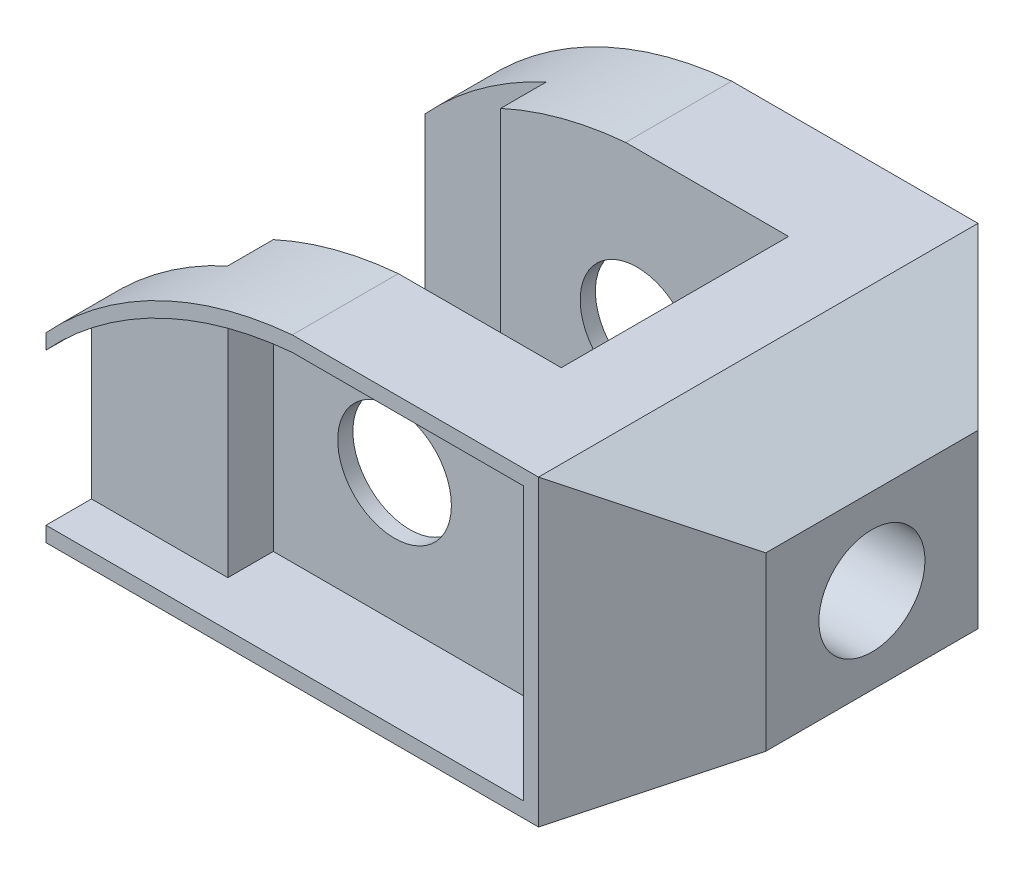
from build123d import *

# Parameters (mm, degrees)
SKETCH1_R               = 7.5
BOSS_EXTRUDE1_DEPTH     = 58
CUT_EXTRUDE1_DEPTH      = 58
SKETCH4_R               = 7
CUT_EXTRUDE2_DEPTH      = 58
CUT_EXTRUDE3_DEPTH      = 96.859271852
CUT_EXTRUDE3_DEPTH_BACK = 6
SKETCH5_R               = 7.5
CUT_EXTRUDE5_START      = -6
CUT_EXTRUDE5_DEPTH      = 6
CUT_EXTRUDE6_DEPTH      = 6
CUT_EXTRUDE7_DEPTH      = 6


with BuildPart() as part:
    # Sketch1 → Boss-Extrude1 (new body)
    with BuildSketch(Plane.XY):
        with BuildLine():
            Line((0, 0), (-65, 0))
            Line((-65, 0), (-65, 24))
            ThreePointArc((-65, 24), (-50.249936753, 35.04674653), (-32.5, 40))
            Line((-32.5, 40), (0, 40))
            Line((0, 40), (15, 31.339745962))
            Line((15, 31.339745962), (15, 8.660254038))
            Line((15, 8.660254038), (0, 0))
        make_face()
        with Locations((-31, 19)):
            Circle(SKETCH1_R, mode=Mode.SUBTRACT)
    extrude(amount=-BOSS_EXTRUDE1_DEPTH)

    # Sketch3 → Cut-Extrude1 (cut)
    with BuildSketch(Plane(origin=(0, 40, 0), x_dir=(1, 0, 0), z_dir=(0, 1, 0))):
        Polygon((-65, 50), (-49, 50), (-49, 44), (-11, 44), (-11, 14), (-49, 14), (-49, 8), (-65, 8), align=None)
        Polygon((0, 58), (15, 43), (15, 58), align=None)
        Polygon((0, 0), (15, 15), (15, 0), align=None)
    extrude(amount=-CUT_EXTRUDE1_DEPTH, mode=Mode.SUBTRACT)

    # Sketch4 → Cut-Extrude2 (cut)
    with BuildSketch(Plane(origin=(15, 0, 0), x_dir=(0, 0, -1), z_dir=(1, 0, 0))):
        with Locations(Location((29, 20, 0), (0, 0, 90))):
            Circle(SKETCH4_R)
    extrude(amount=-CUT_EXTRUDE2_DEPTH, mode=Mode.SUBTRACT)

    # Sketch5 → Cut-Extrude3 (cut, two sides: drawn at the far end of the back side and taken through both)
    with BuildSketch(Plane.XY.offset(-CUT_EXTRUDE3_DEPTH_BACK)):
        with BuildLine():
            Line((-65, 22), (-65, 2))
            Line((-65, 2), (-2, 2))
            Line((-2, 2), (-2, 38))
            Line((-2, 38), (-32.5, 38))
            ThreePointArc((-32.5, 38), (-50.249936753, 33.04674653), (-65, 22))
        make_face()
        with Locations((-31, 19)):
            Circle(SKETCH5_R, mode=Mode.SUBTRACT)
    extrude(amount=CUT_EXTRUDE3_DEPTH + CUT_EXTRUDE3_DEPTH_BACK, mode=Mode.SUBTRACT)

    # Sketch7 → Cut-Extrude5 (cut)
    with BuildSketch(Plane.XY.offset(-6).offset(CUT_EXTRUDE5_START)):
        with BuildLine():
            Line((-47, 34.505277409), (-47, 2))
            Line((-47, 2), (-2, 2))
            Line((-2, 2), (-2, 38))
            Line((-2, 38), (-32.5, 38))
            ThreePointArc((-32.5, 38), (-39.881044096, 36.796355507), (-47, 34.505277409))
        make_face()
    extrude(amount=CUT_EXTRUDE5_DEPTH, mode=Mode.SUBTRACT)

    # Sketch8 → Cut-Extrude6 (cut)
    with BuildSketch(Plane(origin=(0, 0, -58), x_dir=(-1, 0, 0), z_dir=(0, 0, -1))):
        with BuildLine():
            Line((2, 2), (65, 2))
            Line((65, 2), (65, 22))
            ThreePointArc((65, 22), (50.249936753, 33.04674653), (32.5, 38))
            Line((32.5, 38), (2, 38))
            Line((2, 38), (2, 2))
        make_face()
    extrude(amount=-CUT_EXTRUDE6_DEPTH, mode=Mode.SUBTRACT)

    # Sketch9 → Cut-Extrude7 (cut)
    with BuildSketch(Plane(origin=(0, 0, -52), x_dir=(-1, 0, 0), z_dir=(0, 0, -1))):
        with BuildLine():
            Line((47, 34.505277409), (47, 2))
            Line((47, 2), (2, 2))
            Line((2, 2), (2, 38))
            Line((2, 38), (32.5, 38))
            ThreePointArc((32.5, 38), (39.881044096, 36.796355507), (47, 34.505277409))
        make_face()
    extrude(amount=-CUT_EXTRUDE7_DEPTH, mode=Mode.SUBTRACT)


solid = part.part
